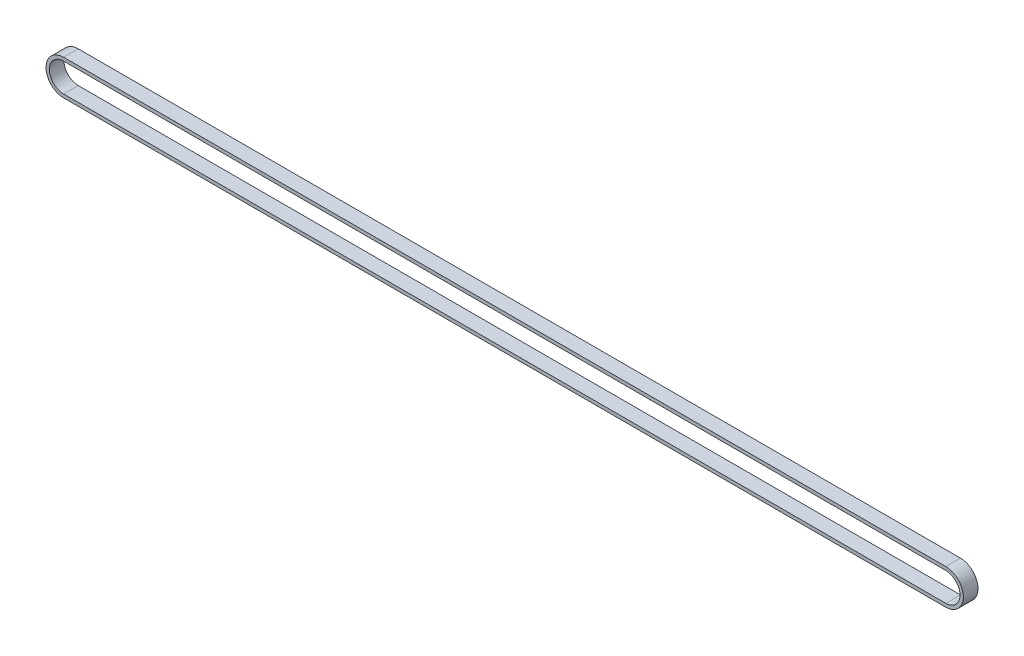
from build123d import *

# Parameters (mm, degrees)
BOSS_EXTRUDE1_DEPTH = 6


with BuildPart() as part:
    # Sketch1 → Boss-Extrude1 (new body)
    with BuildSketch(Plane.XY):
        with BuildLine():
            Line((0, 7.213), (361.5, 7.213))
            ThreePointArc((361.5, 7.213), (368.713, 0), (361.5, -7.213))
            Line((361.5, -7.213), (0, -7.213))
            ThreePointArc((0, -7.213), (-7.213, 0), (0, 7.213))
        make_face()
        with BuildLine():
            Line((0, 5.833), (361.5, 5.833))
            ThreePointArc((361.5, 5.833), (367.333, 0), (361.5, -5.833))
            Line((361.5, -5.833), (0, -5.833))
            ThreePointArc((0, -5.833), (-5.833, 0), (0, 5.833))
        make_face(mode=Mode.SUBTRACT)
    extrude(amount=BOSS_EXTRUDE1_DEPTH)


solid = part.part
